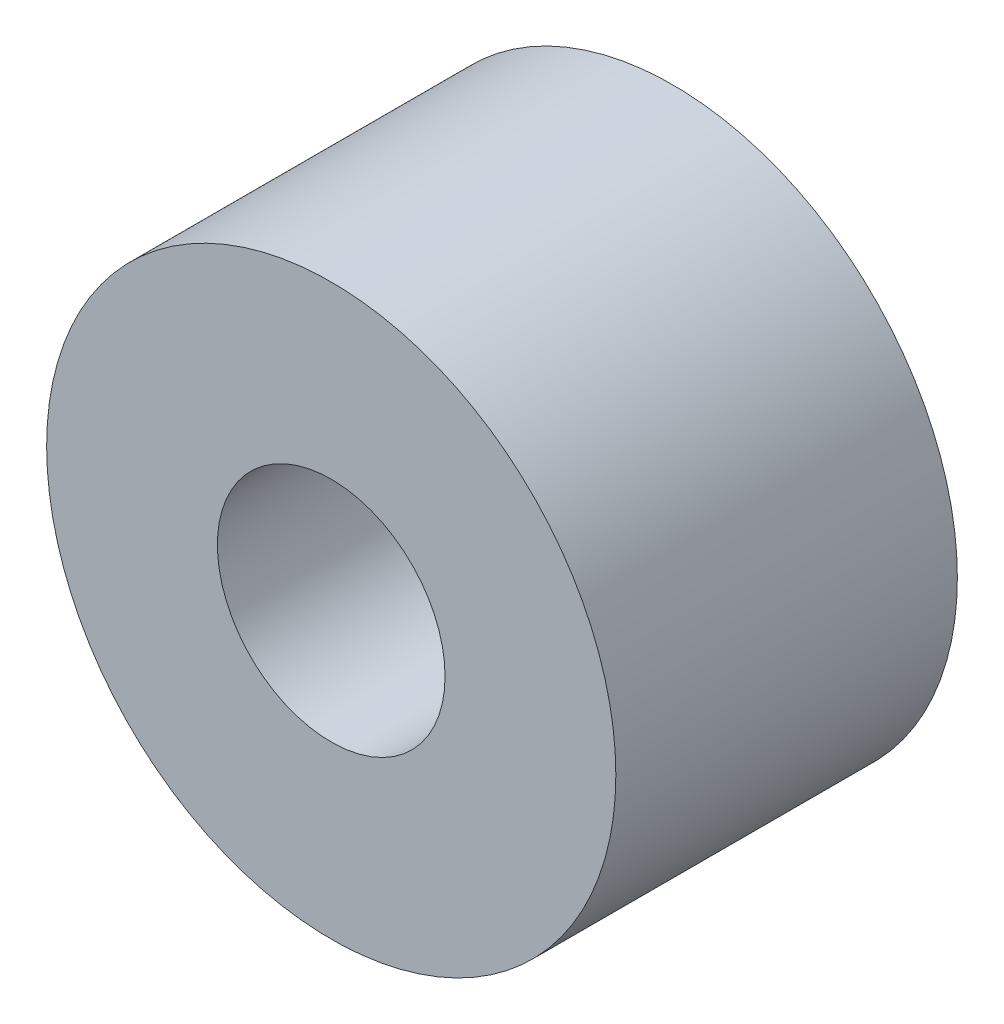
from build123d import *

# Parameters (mm, degrees)
SKETCH1_R           = 2.5
SKETCH1_R_2         = 1
BOSS_EXTRUDE1_DEPTH = 3


with BuildPart() as part:
    # Sketch1 → Boss-Extrude1 (new body)
    with BuildSketch(Plane.XY):
        Circle(SKETCH1_R)
        Circle(SKETCH1_R_2, mode=Mode.SUBTRACT)
    extrude(amount=BOSS_EXTRUDE1_DEPTH)


solid = part.part
